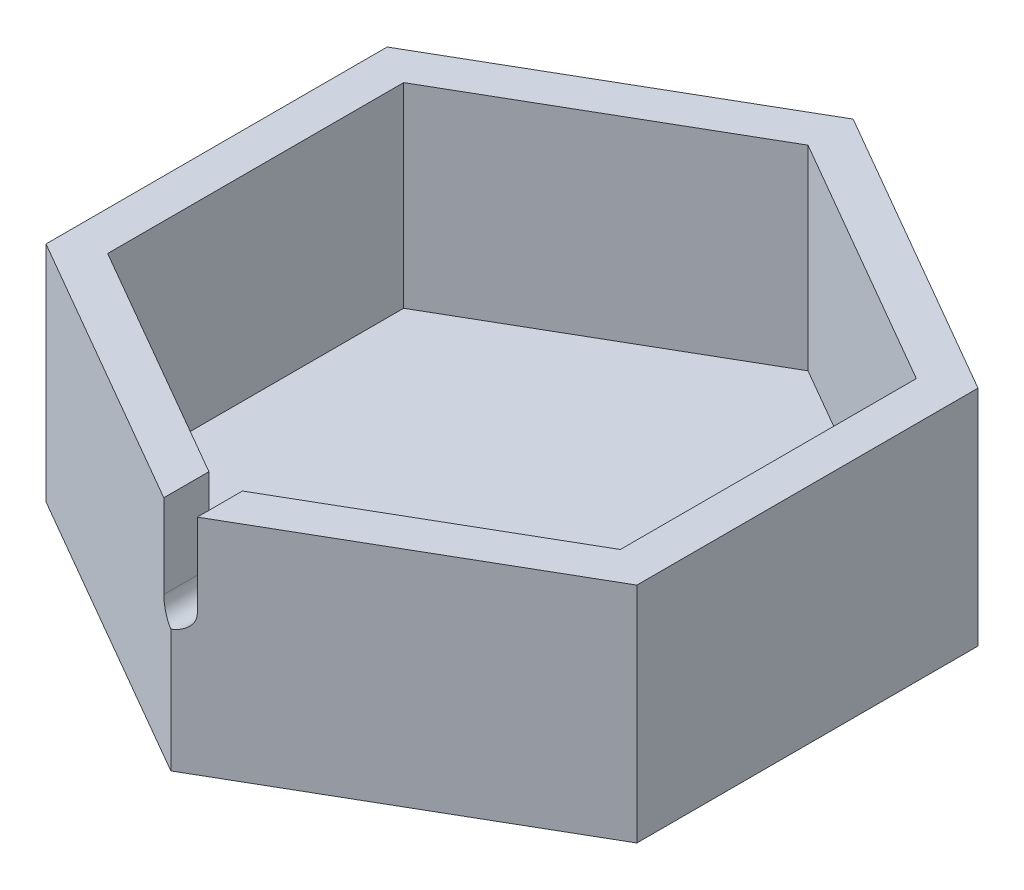
from build123d import *

# Parameters (mm, degrees)
BOSS_EXTRUDE1_DEPTH = 40
BOSS_EXTRUDE5_DEPTH = 5
CUT_EXTRUDE2_DEPTH  = 19.5


with BuildPart() as part:
    # Sketch2 → Boss-Extrude1 (new body)
    with BuildSketch(Plane(origin=(0, 0, 0), x_dir=(1, 0, 0), z_dir=(0, 1, 0))):
        Polygon((52.905102206, -30.544775), (52.905102206, 30.544775), (0, 61.08955), (-52.905102206, 30.544775), (-52.905102206, -30.544775), (0, -61.08955), align=None)
        Polygon((45.905102206, -26.503323116), (45.905102206, 26.503323116), (0, 53.006646231), (-45.905102206, 26.503323116), (-45.905102206, -26.503323116), (0, -53.006646231), align=None, mode=Mode.SUBTRACT)
    extrude(amount=BOSS_EXTRUDE1_DEPTH)

    # Sketch7 → Boss-Extrude5 (add)
    with BuildSketch(Plane.XZ):
        Polygon((-49.405102206, 28.524049058), (-49.405102206, -28.524049058), (0, -57.048098116), (49.405102206, -28.524049058), (49.405102206, 28.524049058), (0, 57.048098116), align=None)
    extrude(amount=-BOSS_EXTRUDE5_DEPTH)

    # Sketch8 → Cut-Extrude2 (cut, symmetric)
    with BuildSketch(Plane.XY.offset(61)):
        with BuildLine():
            Line((3, 40), (3, 25))
            ThreePointArc((3, 25), (2.121320344, 22.878679656), (0, 22))
            ThreePointArc((0, 22), (-2.121320344, 22.878679656), (-3, 25))
            Line((-3, 25), (-3, 40))
            Line((-3, 40), (0, 40))
            Line((0, 40), (3, 40))
        make_face()
    extrude(amount=CUT_EXTRUDE2_DEPTH, both=True, mode=Mode.SUBTRACT)


solid = part.part
